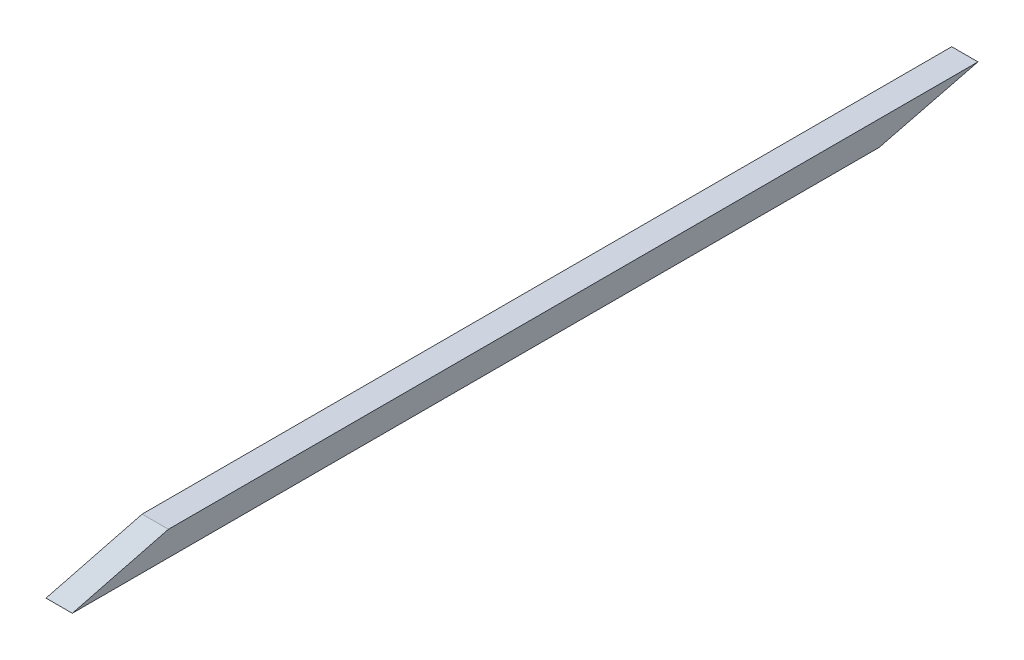
from build123d import *

# Parameters (mm, degrees)
SKETCH1_W           = 50
SKETCH1_H           = 47
BOSS_EXTRUDE1_DEPTH = 1724.16
CUT_EXTRUDE1_DEPTH  = 50


with BuildPart() as part:
    # Sketch1 → Boss-Extrude1 (new body)
    with BuildSketch(Plane.XY):
        with Locations((-4.191409651, 6.329545455)):
            Rectangle(SKETCH1_W, SKETCH1_H)
    extrude(amount=BOSS_EXTRUDE1_DEPTH)

    # Sketch2 → Cut-Extrude1 (cut)
    with BuildSketch(Plane(origin=(20.808590349, 0, 0), x_dir=(0, 0, -1), z_dir=(1, 0, 0))):
        Polygon((-1724.16, -17.170454545), (-1541.118037165, 29.829545455), (-1724.16, 29.829545455), align=None)
        Polygon((0, 29.829545455), (0, -17.170454545), (-188.196619138, -17.170454545), align=None)
    extrude(amount=-CUT_EXTRUDE1_DEPTH, mode=Mode.SUBTRACT)


solid = part.part
